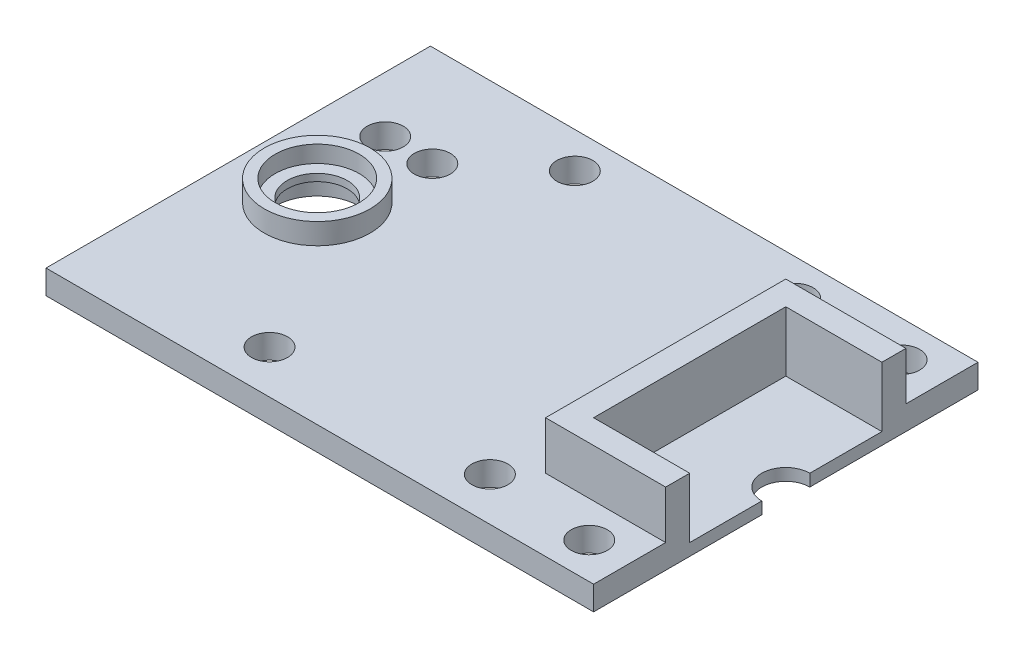
from build123d import *

# Parameters (mm, degrees)
SKETCH1_W                = 279.4
SKETCH1_H                = 101.6
BOSS_EXTRUDE1_DEPTH      = 6.35
SKETCH2_R                = 13.97
BOSS_EXTRUDE3_DEPTH      = 5.55625
SKETCH9_R                = 11.1125
CUT_EXTRUDE4_DEPTH       = 4.445
CUT_EXTRUDE5_START       = -5.55625
SKETCH10_R               = 11.1125
CUT_EXTRUDE5_DEPTH       = 5.55625
SKETCH11_R               = 7.9375
CUT_EXTRUDE6_DEPTH       = 285.078633923
SKETCH12_R               = 6.35
CUT_EXTRUDE7_DEPTH       = 285.051619429
SKETCH22_W               = 63.5
SKETCH22_H               = 63.5
BOSS_EXTRUDE7_DEPTH      = 12.7
SKETCH25_W               = 50.8
SKETCH25_H               = 50.8
CUT_EXTRUDE11_DEPTH      = 15.875
SKETCH32_R               = 4.7625
CUT_EXTRUDE12_DEPTH      = 6.35
SKETCH38_W               = 46.99
SKETCH38_H               = 18.470251096
CUT_EXTRUDE13_DEPTH      = 6.35
SKETCH60_R               = 4.7625
CUT_EXTRUDE23_DEPTH      = 6.35
SKETCH64_R               = 4.7625
CUT_EXTRUDE24_DEPTH      = 285.264471927
SKETCH69_W               = 33.02
SKETCH69_H               = 6.35
BOSS_EXTRUDE10_DEPTH     = 19.05
SKETCH70_R               = 4.7625
SKETCH70_R_2             = 2.54
CUT_EXTRUDE26_DEPTH      = 6.35
SKETCH76_R               = 4.7625
CUT_EXTRUDE29_DEPTH      = 6.35
SKETCH77_W               = 46.99
SKETCH77_H               = 16.7871648
CUT_EXTRUDE30_DEPTH      = 6.35
SKETCH78_W               = 49.276
SKETCH78_H               = 66.342584104
CUT_EXTRUDE32_DEPTH      = 1.524
SKETCH79_R               = 4.7625
CUT_EXTRUDE33_DEPTH      = 4.826
CUT_EXTRUDE34_DEPTH      = 289.436124861
CUT_EXTRUDE34_DEPTH_BACK = 289.436124861


with BuildPart() as part:
    # Sketch1 → Boss-Extrude1 (new body)
    with BuildSketch(Plane(origin=(0, 0, 0), x_dir=(1, 0, 0), z_dir=(0, 1, 0))):
        with Locations((-139.7, 0)):
            Rectangle(SKETCH1_W, SKETCH1_H)
    extrude(amount=BOSS_EXTRUDE1_DEPTH)

    # Sketch2 → Boss-Extrude3 (add)
    with BuildSketch(Plane(origin=(0, 6.35, 0), x_dir=(1, 0, 0), z_dir=(0, 1, 0))):
        with Locations(Location((-258.510557857, 0, 0), (0, 0, 90))):
            Circle(SKETCH2_R)
    extrude(amount=BOSS_EXTRUDE3_DEPTH)

    # Sketch9 → Cut-Extrude4 (cut)
    with BuildSketch(Plane(origin=(0, 11.90625, 0), x_dir=(1, 0, 0), z_dir=(0, 1, 0))):
        with Locations(Location((-258.510557857, 0, 0), (0, 0, 270))):
            Circle(SKETCH9_R)
    extrude(amount=-CUT_EXTRUDE4_DEPTH, mode=Mode.SUBTRACT)

    # Sketch10 → Cut-Extrude5 (cut)
    with BuildSketch(Plane(origin=(0, 0, 0), x_dir=(-1, 0, 0), z_dir=(0, -1, 0)).offset(CUT_EXTRUDE5_START)):
        with Locations(Location((258.510557857, 0, 0), (0, 0, 270))):
            Circle(SKETCH10_R)
    extrude(amount=CUT_EXTRUDE5_DEPTH, mode=Mode.SUBTRACT)

    # Sketch11 → Cut-Extrude6 (cut, through all)
    with BuildSketch(Plane(origin=(0, 7.46125, 0), x_dir=(1, 0, 0), z_dir=(0, 1, 0))):
        with Locations(Location((-258.510557857, 0, 0), (0, 0, 270))):
            Circle(SKETCH11_R)
    extrude(amount=-CUT_EXTRUDE6_DEPTH, mode=Mode.SUBTRACT)

    # Sketch12 → Cut-Extrude7 (cut, through all)
    with BuildSketch(Plane(origin=(0, 6.35, 0), x_dir=(1, 0, 0), z_dir=(0, 1, 0))):
        with Locations(Location((-134.666203771, 0, 0), (0, 0, 270))):
            Circle(SKETCH12_R)
    extrude(amount=-CUT_EXTRUDE7_DEPTH, mode=Mode.SUBTRACT)

    # Sketch22 → Boss-Extrude7 (add)
    with BuildSketch(Plane(origin=(0, 6.35, 0), x_dir=(1, 0, 0), z_dir=(0, 1, 0))):
        with Locations((-134.666203771, 0)):
            Rectangle(SKETCH22_W, SKETCH22_H)
    extrude(amount=BOSS_EXTRUDE7_DEPTH)

    # Sketch25 → Cut-Extrude11 (cut)
    with BuildSketch(Plane(origin=(0, 19.05, 0), x_dir=(1, 0, 0), z_dir=(0, 1, 0))):
        with Locations((-134.666203771, 0)):
            Rectangle(SKETCH25_W, SKETCH25_H)
    extrude(amount=-CUT_EXTRUDE11_DEPTH, mode=Mode.SUBTRACT)

    # Sketch32 → Cut-Extrude12 (cut)
    with BuildSketch(Plane(origin=(0, 6.35, 0), x_dir=(1, 0, 0), z_dir=(0, 1, 0))):
        with Locations(Location((-67.44195898, -40.64, 0), (0, 0, 270))):
            Circle(SKETCH32_R)
        with Locations(Location((-81.41195898, -40.64, 0), (0, 0, 270))):
            Circle(SKETCH32_R)
        with Locations(Location((-67.44195898, 40.64, 0), (0, 0, 270))):
            Circle(SKETCH32_R)
        with Locations(Location((-81.41195898, 40.64, 0), (0, 0, 270))):
            Circle(SKETCH32_R)
    extrude(amount=-CUT_EXTRUDE12_DEPTH, mode=Mode.SUBTRACT)

    # Sketch38 → Cut-Extrude13 (cut)
    with BuildSketch(Plane(origin=(0, 6.35, 0), x_dir=(1, 0, 0), z_dir=(0, 1, 0))):
        with Locations((-23.495, -24.777709652)):
            Rectangle(SKETCH38_W, SKETCH38_H)
    extrude(amount=-CUT_EXTRUDE13_DEPTH, mode=Mode.SUBTRACT)

    # Sketch60 → Cut-Extrude23 (cut)
    with BuildSketch(Plane(origin=(0, 6.35, 0), x_dir=(1, 0, 0), z_dir=(0, 1, 0))):
        with Locations(Location((-231.7492444, 41.324145444, 0), (0, 0, 270))):
            Circle(SKETCH60_R)
        with Locations(Location((-231.7492444, -39.369341378, 0), (0, 0, 270))):
            Circle(SKETCH60_R)
        with Locations(Location((-173.509244294, -39.369341378, 0), (0, 0, 270))):
            Circle(SKETCH60_R)
        with Locations(Location((-173.509244294, 41.324145444, 0), (0, 0, 270))):
            Circle(SKETCH60_R)
    extrude(amount=-CUT_EXTRUDE23_DEPTH, mode=Mode.SUBTRACT)

    # Sketch64 → Cut-Extrude24 (cut, through all)
    with BuildSketch(Plane(origin=(0, 6.35, 0), x_dir=(1, 0, 0), z_dir=(0, 1, 0))):
        with Locations(Location((-145.334203771, -41.275, 0), (0, 0, 270))):
            Circle(SKETCH64_R)
        with Locations(Location((-123.998203771, -41.275, 0), (0, 0, 270))):
            Circle(SKETCH64_R)
    cut_extrude24 = extrude(amount=-CUT_EXTRUDE24_DEPTH, mode=Mode.SUBTRACT)

    # Mirror1: Cut-Extrude24 across plane
    add(cut_extrude24.mirror(Plane.XY), mode=Mode.SUBTRACT)

    # Sketch69 → Boss-Extrude10 (add)
    with BuildSketch(Plane.XY.offset(50.8)):
        with Locations((-70.465355554, 3.175)):
            Rectangle(SKETCH69_W, SKETCH69_H)
    boss_extrude10 = extrude(amount=BOSS_EXTRUDE10_DEPTH)

    # Sketch70 → Cut-Extrude26 (cut)
    with BuildSketch(Plane(origin=(0, 6.35, 0), x_dir=(1, 0, 0), z_dir=(0, 1, 0))):
        with Locations(Location((-76.815355554, -60.325, 0), (0, 0, 270))):
            Circle(SKETCH70_R)
        with Locations(Location((-64.115355554, -60.325, 0), (0, 0, 270))):
            Circle(SKETCH70_R_2)
    cut_extrude26 = extrude(amount=-CUT_EXTRUDE26_DEPTH, mode=Mode.SUBTRACT)

    # Mirror2: Boss-Extrude10, Cut-Extrude26 across plane
    add(boss_extrude10.mirror(Plane.XY))
    add(cut_extrude26.mirror(Plane.XY), mode=Mode.SUBTRACT)

    # Sketch76 → Cut-Extrude29 (cut)
    with BuildSketch(Plane(origin=(0, 6.35, 0), x_dir=(1, 0, 0), z_dir=(0, 1, 0))):
        with Locations(Location((-264.668, 24.13, 0), (0, 0, 270))):
            Circle(SKETCH76_R)
        with Locations(Location((-252.222, 24.13, 0), (0, 0, 270))):
            Circle(SKETCH76_R)
    extrude(amount=-CUT_EXTRUDE29_DEPTH, mode=Mode.SUBTRACT)

    # Sketch77 → Cut-Extrude30 (cut)
    with BuildSketch(Plane(origin=(0, 6.35, 0), x_dir=(1, 0, 0), z_dir=(0, 1, 0))):
        with Locations((-23.495, -42.4064176)):
            Rectangle(SKETCH77_W, SKETCH77_H)
    extrude(amount=-CUT_EXTRUDE30_DEPTH, mode=Mode.SUBTRACT)

    # Sketch78 → Cut-Extrude32 (cut)
    with BuildSketch(Plane(origin=(0, 6.35, 0), x_dir=(1, 0, 0), z_dir=(0, 1, 0))):
        with Locations((-24.638, 17.628707948)):
            Rectangle(SKETCH78_W, SKETCH78_H)
    extrude(amount=-CUT_EXTRUDE32_DEPTH, mode=Mode.SUBTRACT)

    # Sketch79 → Cut-Extrude33 (cut)
    with BuildSketch(Plane(origin=(0, 4.826, 0), x_dir=(1, 0, 0), z_dir=(0, 1, 0))):
        with Locations(Location((-23.876, 15.191415896, 0), (0, 0, 270))):
            Circle(SKETCH79_R)
    extrude(amount=-CUT_EXTRUDE33_DEPTH, mode=Mode.SUBTRACT)

    # Sketch80 → Cut-Extrude34 (cut, two sides: drawn at the far end of the back side and taken through both)
    with BuildSketch(Plane(origin=(0, 3.175, 0), x_dir=(1, 0, 0), z_dir=(0, 1, 0)).offset(-CUT_EXTRUDE34_DEPTH_BACK)):
        Polygon((-134.666203771, 437.651664562), (-134.666203771, 50.8), (-134.666203771, 0), (-134.666203771, -50.8), (-134.666203771, -437.651664562), (639.037125352, -437.651664562), (639.037125352, 437.651664562), align=None)
    extrude(amount=CUT_EXTRUDE34_DEPTH + CUT_EXTRUDE34_DEPTH_BACK, mode=Mode.SUBTRACT)


solid = part.part
